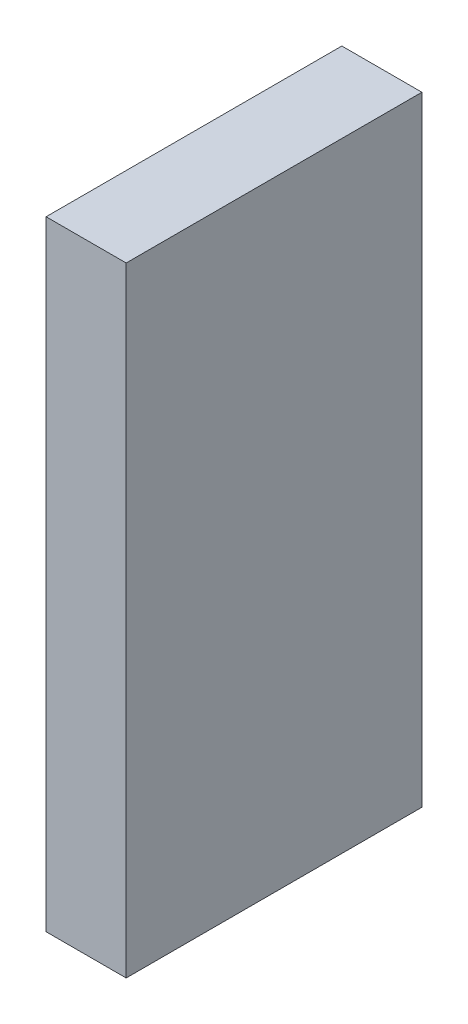
from build123d import *

# Parameters (mm, degrees)
CROQUIS1_W              = 55.4
CROQUIS1_H              = 116
SALIENTE_EXTRUIR1_DEPTH = 15


with BuildPart() as part:
    # Croquis1 → Saliente-Extruir1 (new body)
    with BuildSketch(Plane(origin=(0, 0, 0), x_dir=(0, 0, -1), z_dir=(1, 0, 0))):
        with Locations((27.7, 58)):
            Rectangle(CROQUIS1_W, CROQUIS1_H)
    extrude(amount=SALIENTE_EXTRUIR1_DEPTH)


solid = part.part
